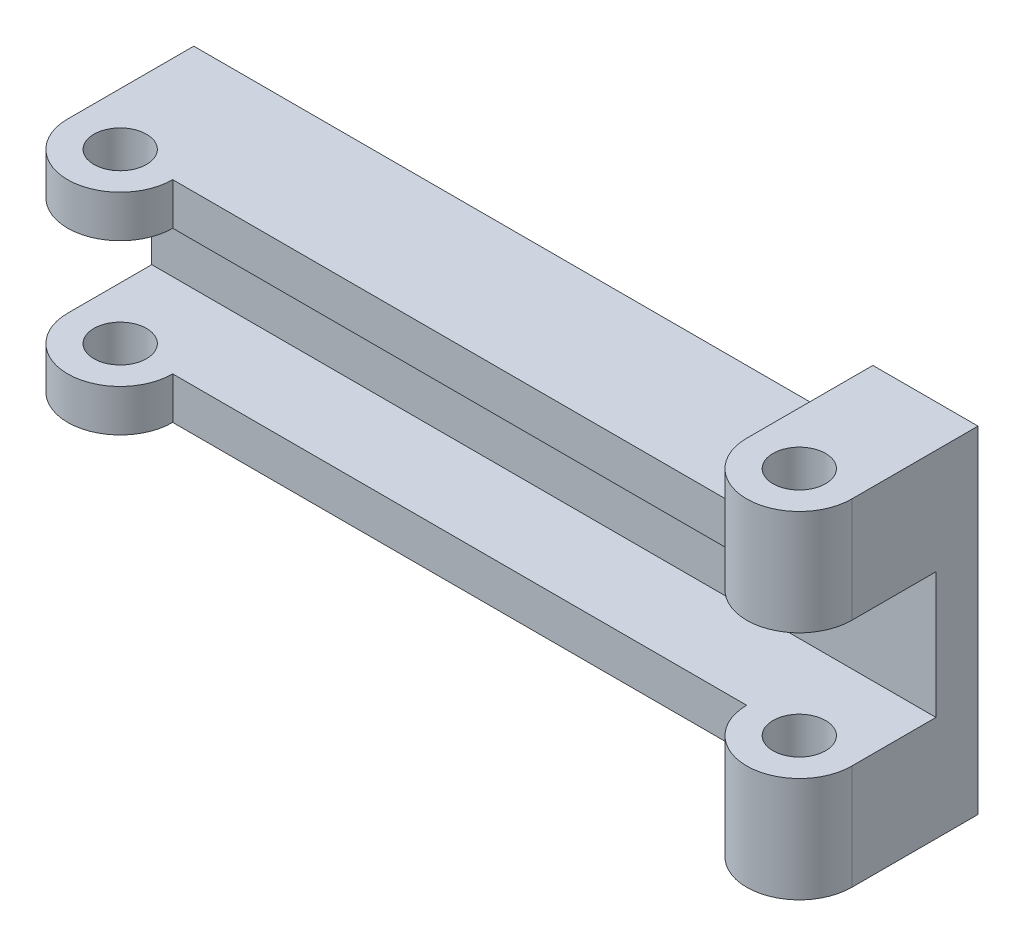
from build123d import *

# Parameters (mm, degrees)
BOSS_EXTRUDE4_DEPTH = 6.35
SKETCH9_R           = 3.96875
BOSS_EXTRUDE5_DEPTH = 15.875
SKETCH10_R          = 3.96875
BOSS_EXTRUDE6_DEPTH = 6.35


with BuildPart() as part:
    # Sketch6 → Boss-Extrude4 (new body)
    with BuildSketch(Plane.XY):
        Polygon((0, 0), (0, -15.875), (102.5525, -15.875), (102.5525, -25.4), (118.4275, -25.4), (118.4275, 0), align=None)
    extrude(amount=BOSS_EXTRUDE4_DEPTH)

    # Sketch9 → Boss-Extrude5 (add)
    with BuildSketch(Plane.XZ.offset(25.4)):
        with BuildLine():
            Line((102.5525, 6.35), (102.5525, 19.05))
            ThreePointArc((102.5525, 19.05), (110.49, 26.9875), (118.4275, 19.05))
            Line((118.4275, 19.05), (118.4275, 6.35))
            Line((118.4275, 6.35), (102.5525, 6.35))
        make_face()
        with Locations(Location((110.49, 19.05, 0), (0, 0, 270))):
            Circle(SKETCH9_R, mode=Mode.SUBTRACT)
    extrude(amount=-BOSS_EXTRUDE5_DEPTH)

    # Sketch10 → Boss-Extrude6 (add)
    with BuildSketch(Plane.XZ.offset(15.875)):
        with BuildLine():
            Line((0, 6.35), (0, 19.05))
            ThreePointArc((0, 19.05), (7.9375, 26.9875), (15.875, 19.05))
            Line((15.875, 19.05), (102.5525, 19.05))
            Line((102.5525, 19.05), (102.5525, 6.35))
            Line((102.5525, 6.35), (0, 6.35))
        make_face()
        with Locations(Location((7.9375, 19.05, 0), (0, 0, 270))):
            Circle(SKETCH10_R, mode=Mode.SUBTRACT)
    extrude(amount=-BOSS_EXTRUDE6_DEPTH)

    # Mirror1: part across plane


with BuildPart() as part_1:
    add(part.part)
    add(part.part.mirror(Plane(origin=(118.4275, 0, 6.35), x_dir=(0, 0, 1), z_dir=(0, -1, 0))))


solid = part_1.part
